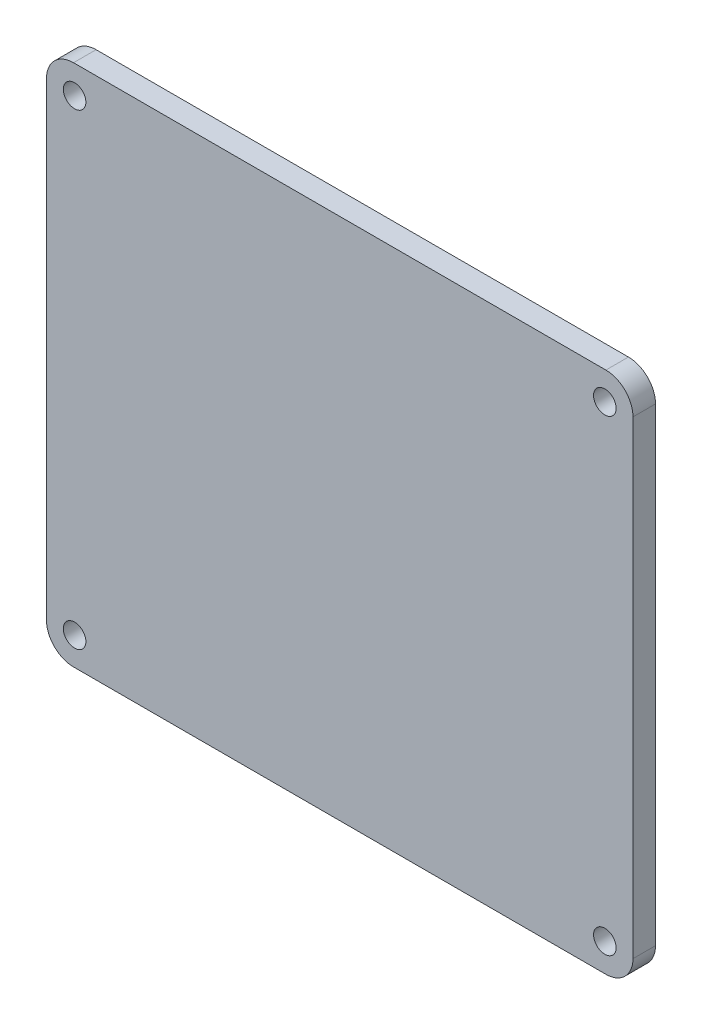
from build123d import *

# Parameters (mm, degrees)
BASE_SKETCH_W       = 65
BASE_SKETCH_H       = 58
BOSS_EXTRUDE2_DEPTH = 2.5
MOUNTING_HOLES_R    = 1.25
CUT_EXTRUDE5_DEPTH  = 2.5
FILLET1_R           = 3


with BuildPart() as part:
    # Base Sketch → Boss-Extrude2 (new body)
    with BuildSketch(Plane.XY):
        with Locations((32.5, 29)):
            Rectangle(BASE_SKETCH_W, BASE_SKETCH_H)
    extrude(amount=BOSS_EXTRUDE2_DEPTH)

    # Mounting Holes → Cut-Extrude5 (cut)
    with BuildSketch(Plane.XY):
        with Locations((3.115503651, 54.884496349)):
            Circle(MOUNTING_HOLES_R)
        with Locations((61.884496349, 54.884496349)):
            Circle(MOUNTING_HOLES_R)
        with Locations((61.884496349, 3.115503651)):
            Circle(MOUNTING_HOLES_R)
        with Locations((3.115503651, 3.115503651)):
            Circle(MOUNTING_HOLES_R)
    extrude(amount=CUT_EXTRUDE5_DEPTH, mode=Mode.SUBTRACT)

    # Fillet1
    fillet1_edges = [part.edges().sort_by_distance(p)[0] for p in [
        (0, 0, 1.25),
        (0, 58, 1.25),
        (65, 58, 1.25),
        (65, 0, 1.25),
    ]]
    fillet(fillet1_edges, radius=FILLET1_R)


solid = part.part
